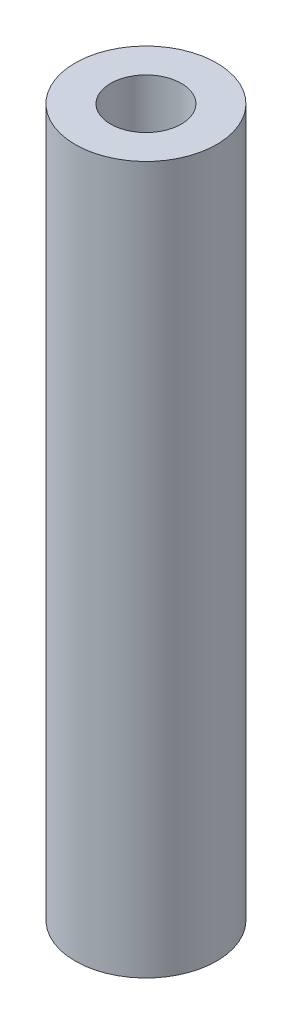
from build123d import *

# Parameters (mm, degrees)
SKETCH_1_R          = 3
EXTRUDE_1_DEPTH     = 30
SKETCH_2_R          = 1.5
CUT_EXTRUDE_1_DEPTH = 6


with BuildPart() as part:
    # 스케치1 → 보스-돌출1 (new body)
    with BuildSketch(Plane(origin=(0, 0, 0), x_dir=(1, 0, 0), z_dir=(0, 1, 0))):
        with Locations(Location((0, 0, 0), (0, 0, 270))):
            Circle(SKETCH_1_R)
    extrude(amount=EXTRUDE_1_DEPTH)

    # 스케치2 → 컷-돌출1 (cut)
    with BuildSketch(Plane(origin=(0, 30, 0), x_dir=(1, 0, 0), z_dir=(0, 1, 0))):
        with Locations(Location((0, 0, 0), (0, 0, 270))):
            Circle(SKETCH_2_R)
    extrude(amount=-CUT_EXTRUDE_1_DEPTH, mode=Mode.SUBTRACT)


solid = part.part
